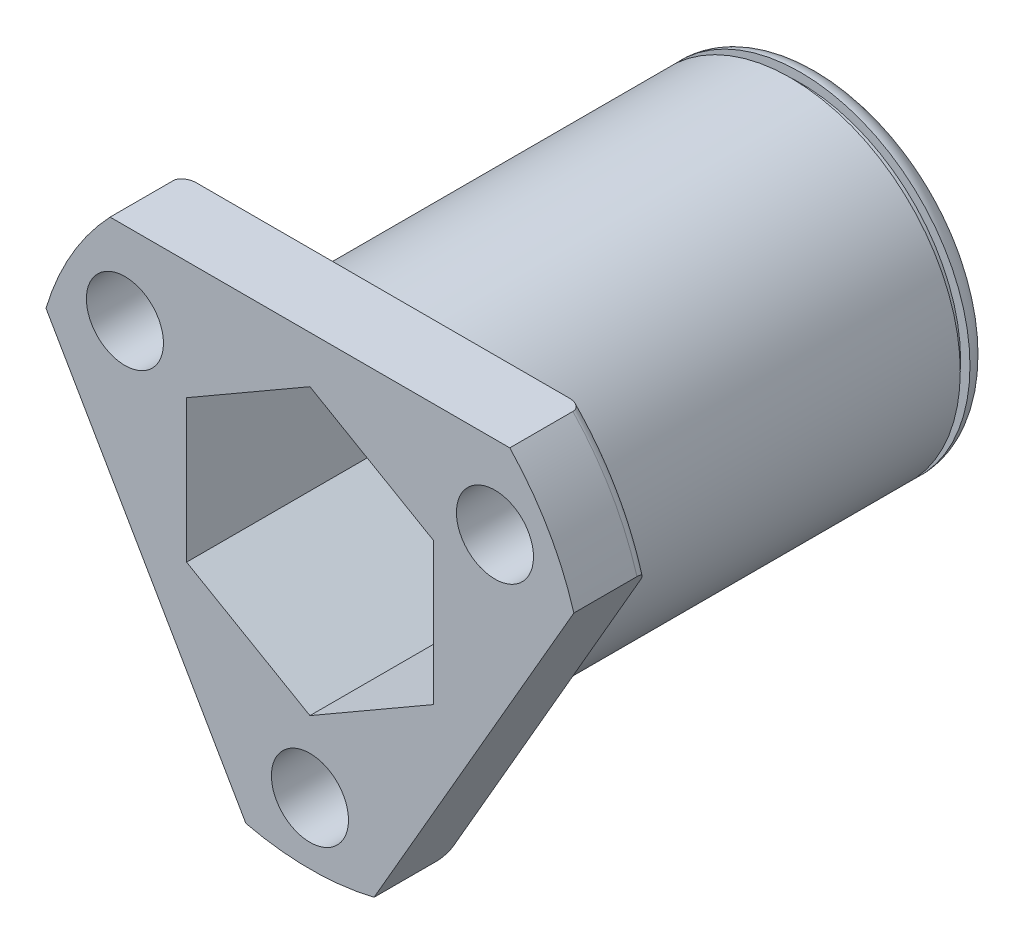
from build123d import *

# Parameters (mm, degrees)
SKETCH2_R          = 3.96875
CUT_EXTRUDE1_DEPTH = 69.062067304
SKETCH4_W          = 91.060119334
SKETCH4_H          = 85.338920038
CUT_EXTRUDE2_DEPTH = 10
SKETCH5_W          = 59.127494052
SKETCH5_H          = 59.423778288
CUT_EXTRUDE3_DEPTH = 2.5


with BuildPart() as part:
    # Sketch1 → Revolve1 (revolve)
    with BuildSketch(Plane(origin=(0, 0, 0), x_dir=(0, 0, -1), z_dir=(1, 0, 0)), mode=Mode.PRIVATE) as revolve1_sk:
        with BuildLine():
            Line((0, 27.35), (0, 0))
            Line((0, 0), (55, 0))
            Line((55, 0), (55, 15.4625))
            ThreePointArc((55, 15.4625), (54.414213562, 16.876713562), (53, 17.4625))
            Line((53, 17.4625), (53, 16.5))
            Line((53, 16.5), (52, 16.5))
            Line((52, 16.5), (52, 17.4625))
            Line((52, 17.4625), (11, 17.4625))
            ThreePointArc((11, 17.4625), (10.292893219, 17.755393219), (10, 18.4625))
            Line((10, 18.4625), (10, 27.35))
            ThreePointArc((10, 27.35), (9.707106781, 28.057106781), (9, 28.35))
            Line((9, 28.35), (1, 28.35))
            ThreePointArc((1, 28.35), (0.292893219, 28.057106781), (0, 27.35))
        make_face()
    revolve(revolve1_sk.sketch.rotate(Axis((0, 0, 0), (0, 0, -1)), 90), axis=Axis((0, 0, 0), (0, 0, -1)))

    # Sketch2 → Cut-Extrude1 (cut, through all)
    with BuildSketch(Plane.XY):
        with Locations((-19.05, 10.998522628)):
            Circle(SKETCH2_R)
        with Locations((19.05, 10.998522628)):
            Circle(SKETCH2_R)
        with Locations((0, -21.997045256)):
            Circle(SKETCH2_R)
        Polygon((0, 14.664696837), (-12.7, 7.332348419), (-12.7, -7.332348419), (0, -14.664696837), (12.7, -7.332348419), (12.7, 7.332348419), align=None)
    extrude(amount=-CUT_EXTRUDE1_DEPTH, mode=Mode.SUBTRACT)

    # Sketch3 → Cut-Revolve2 (revolve, cut)
    with BuildSketch(Plane(origin=(0, 0, 0), x_dir=(0, 0, -1), z_dir=(1, 0, 0))):
        Polygon((0, 14.664696837), (0, 11.164696837), (3.5, 11.164696837), align=None)
        Polygon((51.5, 11.164696837), (55, 11.164696837), (55, 14.664696837), align=None)
    revolve(axis=Axis((0, 0, -55), (0, 0, 1)), mode=Mode.SUBTRACT)

    # Sketch4 → Cut-Extrude2 (cut)
    with BuildSketch(Plane(origin=(0, 0, -10), x_dir=(-1, 0, 0), z_dir=(0, 0, -1))):
        Rectangle(SKETCH4_W, SKETCH4_H)
        Polygon((0, -39), (33.774990748, 19.5), (-33.774990748, 19.5), align=None, mode=Mode.SUBTRACT)
    extrude(amount=-CUT_EXTRUDE2_DEPTH, mode=Mode.SUBTRACT)

    # Sketch5 → Cut-Extrude3 (cut)
    with BuildSketch(Plane.XY):
        Rectangle(SKETCH5_W, SKETCH5_H)
    extrude(amount=-CUT_EXTRUDE3_DEPTH, mode=Mode.SUBTRACT)


solid = part.part
